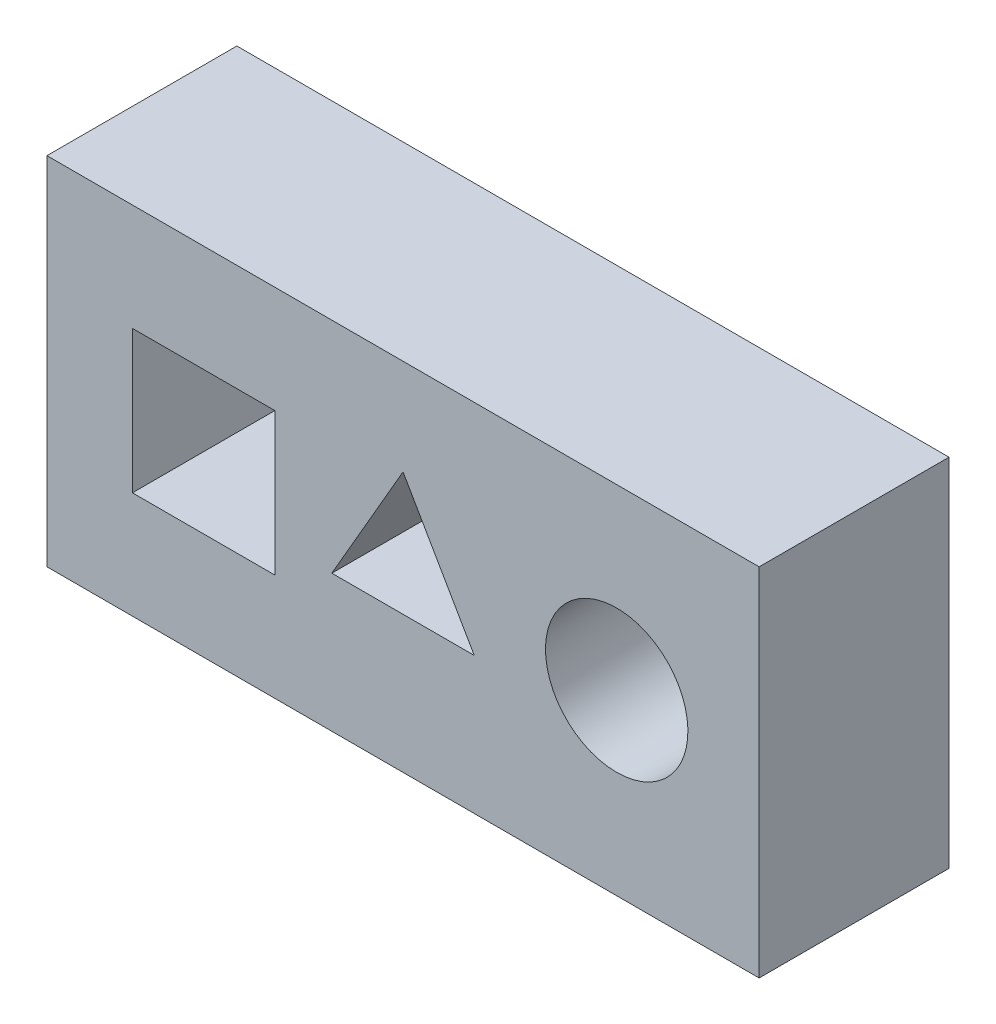
from build123d import *

# Parameters (mm, degrees)
SKETCH1_W           = 250
SKETCH1_H           = 125
SKETCH1_W_2         = 230
SKETCH1_H_2         = 115
BOSS_EXTRUDE1_DEPTH = 100
SKETCH3_W           = 250
SKETCH3_H           = 125
SKETCH3_W_2         = 230
SKETCH3_H_2         = 115
SKETCH3_R           = 25
SKETCH3_W_3         = 50
SKETCH3_H_3         = 50
BOSS_EXTRUDE4_DEPTH = 100
SCALE2_SCALE_X      = 1.2
SCALE2_SCALE_Y      = 1.2
SCALE2_SCALE_Z      = 0.8


with BuildPart() as part:
    # Sketch1 → Boss-Extrude1 (new body)
    with BuildSketch(Plane.XY):
        Rectangle(SKETCH1_W, SKETCH1_H)
        Rectangle(SKETCH1_W_2, SKETCH1_H_2, mode=Mode.SUBTRACT)
    extrude(amount=BOSS_EXTRUDE1_DEPTH)

    # Sketch3 → Boss-Extrude4 (add)
    # profile 1 of 2: a face of its own
    with BuildSketch(Plane.XY.offset(100)):
        Rectangle(SKETCH3_W, SKETCH3_H)
        Rectangle(SKETCH3_W_2, SKETCH3_H_2, mode=Mode.SUBTRACT)
    # profile 2 of 2: a face of its own
    with BuildSketch(Plane.XY.offset(100)):
        Rectangle(SKETCH3_W_2, SKETCH3_H_2)
        with Locations((75, 0)):
            Circle(SKETCH3_R, mode=Mode.SUBTRACT)
        with Locations((-70, 0)):
            Rectangle(SKETCH3_W_3, SKETCH3_H_3, mode=Mode.SUBTRACT)
        Polygon((0, 28.867513459), (25, -14.43375673), (-25, -14.43375673), align=None, mode=Mode.SUBTRACT)
    extrude(amount=-BOSS_EXTRUDE4_DEPTH)


with BuildPart() as part_1:
    # Scale2: scaled about (1.079126738, 0, 50)
    add(part.part.scale((SCALE2_SCALE_X, SCALE2_SCALE_Y, SCALE2_SCALE_Z), about=(1.079126738, 0, 50)))


solid = part_1.part
